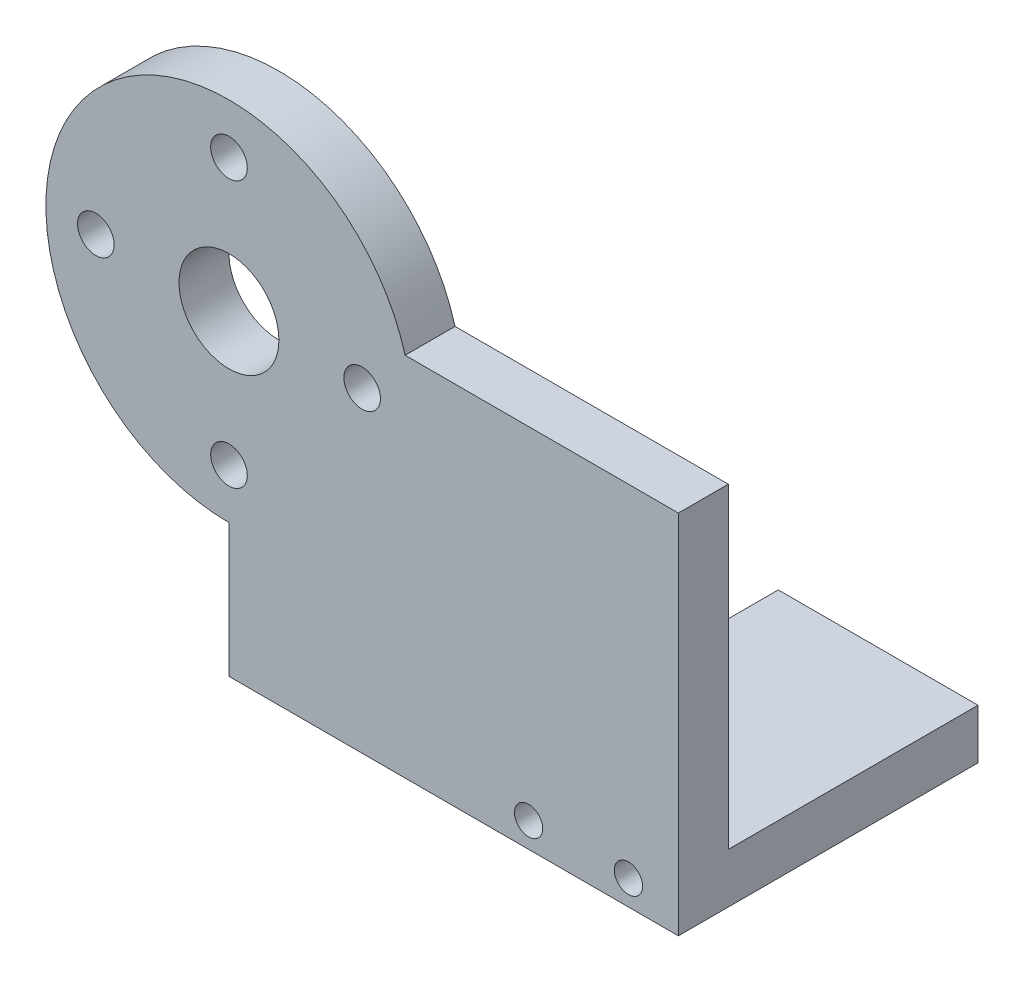
from build123d import *

# Parameters (mm, degrees)
STOCK_HORN_ATTACHMENT_START         = 15
STOCK_HORN_ATTACHMENT_PROFILE_R     = 11
STOCK_HORN_ATTACHMENT_DEPTH         = 3
FINGER_ARM_START                    = 15
FINGER_ARM_PROFILE_W                = 27
FINGER_ARM_PROFILE_H                = 22
FINGER_ARM_DEPTH                    = 3
DESCENDING_CONTACT_FINGER_PROFILE_W = 12
DESCENDING_CONTACT_FINGER_PROFILE_H = 3
DESCENDING_CONTACT_FINGER_DEPTH     = 18
HORN_CENTER_ACCESS_START            = -50
HORN_CENTER_ACCESS_PROFILE_R        = 3
HORN_CENTER_ACCESS_DEPTH            = 88.603191354
HORN_SCREWS_START                   = -50
HORN_SCREWS_PROFILE_R               = 1.1
HORN_SCREWS_DEPTH                   = 88.603191354
CONTACT_PAD_KEEPER_START            = -50
CONTACT_PAD_KEEPER_PROFILE_R        = 0.85
CONTACT_PAD_KEEPER_DEPTH            = 88.603191354


with BuildPart() as part:
    # Stock_horn_attachment_profile → Stock_horn_attachment (new body)
    with BuildSketch(Plane.XY.offset(STOCK_HORN_ATTACHMENT_START)):
        Circle(STOCK_HORN_ATTACHMENT_PROFILE_R)
    extrude(amount=STOCK_HORN_ATTACHMENT_DEPTH)

    # Finger_arm_profile → Finger_arm (add)
    with BuildSketch(Plane.XY.offset(FINGER_ARM_START)):
        with Locations((13.5, -8)):
            Rectangle(FINGER_ARM_PROFILE_W, FINGER_ARM_PROFILE_H)
    extrude(amount=FINGER_ARM_DEPTH)

    # Descending_contact_finger_profile → Descending_contact_finger (add)
    with BuildSketch(Plane.XY):
        with Locations((21, -17.5)):
            Rectangle(DESCENDING_CONTACT_FINGER_PROFILE_W, DESCENDING_CONTACT_FINGER_PROFILE_H)
    extrude(amount=DESCENDING_CONTACT_FINGER_DEPTH)

    # Horn_center_access_profile → Horn_center_access (cut, through all)
    with BuildSketch(Plane.XY.offset(HORN_CENTER_ACCESS_START)):
        Circle(HORN_CENTER_ACCESS_PROFILE_R)
    extrude(amount=HORN_CENTER_ACCESS_DEPTH, mode=Mode.SUBTRACT)

    # Horn_screws_profile → Horn_screws (cut, through all)
    with BuildSketch(Plane.XY.offset(HORN_SCREWS_START)):
        with Locations((0, -8)):
            Circle(HORN_SCREWS_PROFILE_R)
        with Locations((0, 8)):
            Circle(HORN_SCREWS_PROFILE_R)
        with Locations((-8, 0)):
            Circle(HORN_SCREWS_PROFILE_R)
        with Locations((8, 0)):
            Circle(HORN_SCREWS_PROFILE_R)
    extrude(amount=HORN_SCREWS_DEPTH, mode=Mode.SUBTRACT)

    # Contact_pad_keeper_profile → Contact_pad_keeper (cut, through all)
    with BuildSketch(Plane.XY.offset(CONTACT_PAD_KEEPER_START)):
        with Locations(Location((18, -17.5, 0), (0, 0, 180))):
            Circle(CONTACT_PAD_KEEPER_PROFILE_R)
        with Locations(Location((24, -17.5, 0), (0, 0, 180))):
            Circle(CONTACT_PAD_KEEPER_PROFILE_R)
    extrude(amount=CONTACT_PAD_KEEPER_DEPTH, mode=Mode.SUBTRACT)


solid = part.part
